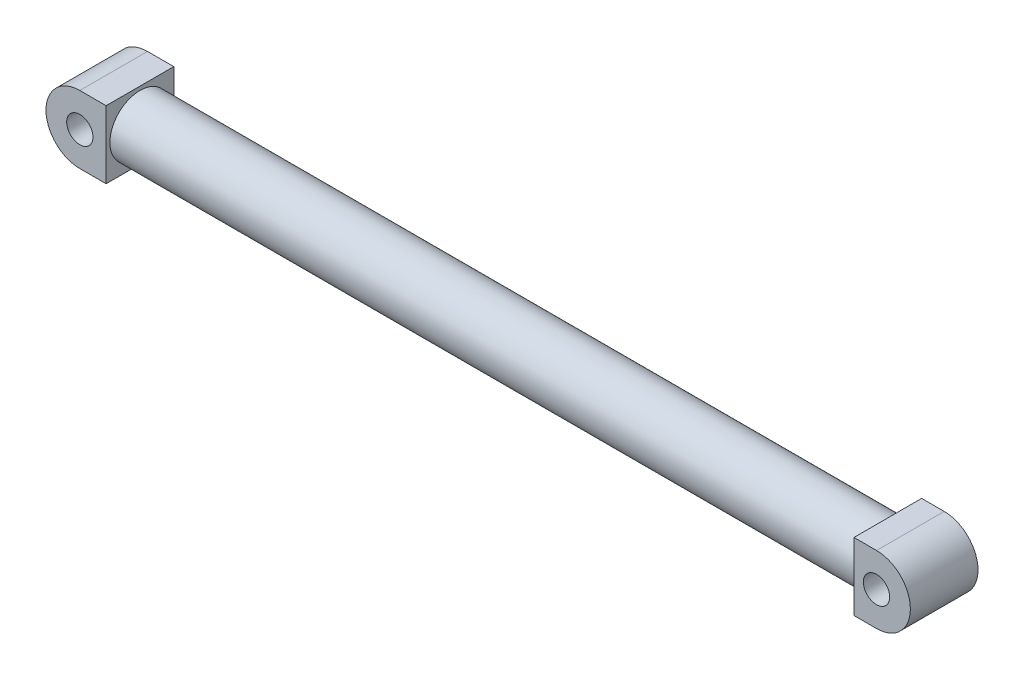
from build123d import *

# Parameters (mm, degrees)
SKETCH5_R           = 1.75
BOSS_EXTRUDE3_DEPTH = 9
CUT_EXTRUDE2_START  = 3.5
SKETCH7_R           = 7.5
SKETCH7_R_2         = 4
CUT_EXTRUDE2_DEPTH  = 99.5


with BuildPart() as part:
    # Sketch5 → Boss-Extrude3 (new body)
    with BuildSketch(Plane.XY):
        with BuildLine():
            Line((0, 4.5), (106, 4.5))
            ThreePointArc((106, 4.5), (110.5, 0), (106, -4.5))
            Line((106, -4.5), (0, -4.5))
            ThreePointArc((0, -4.5), (-4.5, 0), (0, 4.5))
        make_face()
        Circle(SKETCH5_R, mode=Mode.SUBTRACT)
        with Locations((106, 0)):
            Circle(SKETCH5_R, mode=Mode.SUBTRACT)
    extrude(amount=BOSS_EXTRUDE3_DEPTH)

    # Sketch7 → Cut-Extrude2 (cut)
    with BuildSketch(Plane(origin=(0, 0, 0), x_dir=(0, 0, -1), z_dir=(1, 0, 0)).offset(CUT_EXTRUDE2_START)):
        with Locations((-4.5, 0)):
            Circle(SKETCH7_R)
        with Locations((-4.5, 0)):
            Circle(SKETCH7_R_2, mode=Mode.SUBTRACT)
    extrude(amount=CUT_EXTRUDE2_DEPTH, mode=Mode.SUBTRACT)


solid = part.part
